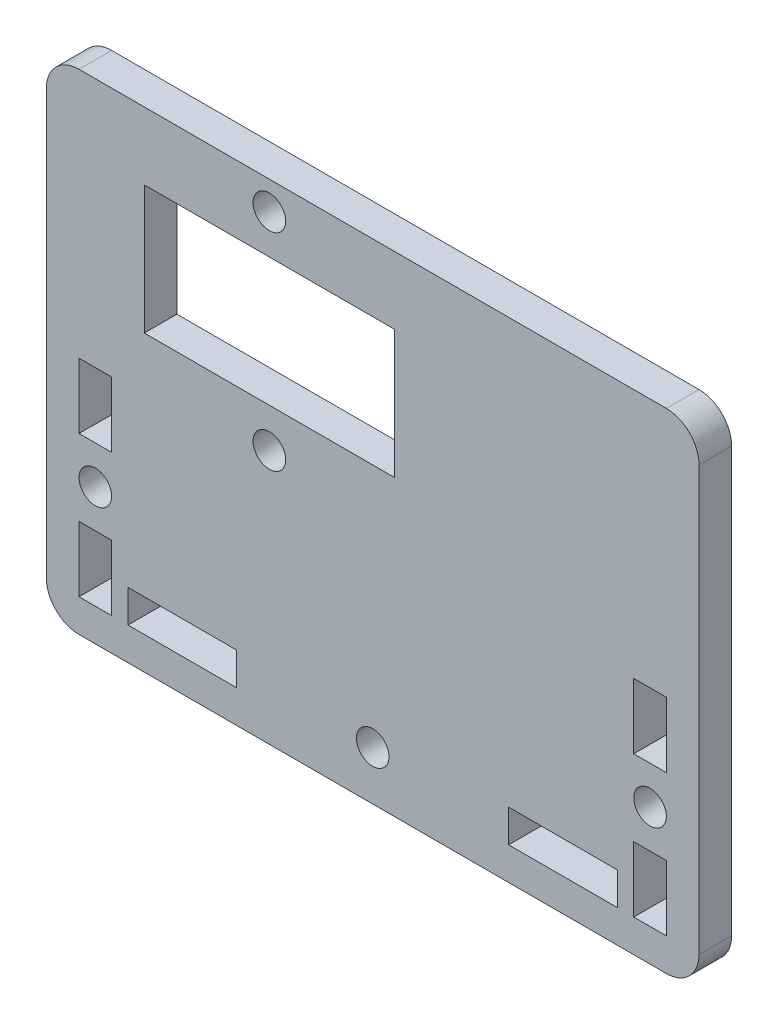
from build123d import *

# Parameters (mm, degrees)
ESQUISSE12_R        = 1.5
ESQUISSE12_W        = 3
ESQUISSE12_H        = 6
ESQUISSE12_W_2      = 10
ESQUISSE12_H_2      = 3
ESQUISSE12_W_3      = 23
ESQUISSE12_H_3      = 11.8
BOSS_EXTRU_12_DEPTH = 3


with BuildPart() as part:
    # Esquisse12 → Boss.-Extru.12 (new body)
    with BuildSketch(Plane.XY):
        with BuildLine():
            Line((218.080291561, -14.564673514), (164.080291561, -14.564673514))
            ThreePointArc((164.080291561, -14.564673514), (161.958971217, -13.685993857), (161.080291561, -11.564673514))
            Line((161.080291561, -11.564673514), (161.080291561, 27.435326486))
            ThreePointArc((161.080291561, 27.435326486), (161.958971217, 29.55664683), (164.080291561, 30.435326486))
            Line((164.080291561, 30.435326486), (218.080291561, 30.435326486))
            ThreePointArc((218.080291561, 30.435326486), (220.201611904, 29.55664683), (221.080291561, 27.435326486))
            Line((221.080291561, 27.435326486), (221.080291561, -11.564673514))
            ThreePointArc((221.080291561, -11.564673514), (220.201611904, -13.685993857), (218.080291561, -14.564673514))
        make_face()
        with Locations((191.080291561, -10.064673514)):
            Circle(ESQUISSE12_R, mode=Mode.SUBTRACT)
        with Locations((181.580291561, 8.835326486)):
            Circle(ESQUISSE12_R, mode=Mode.SUBTRACT)
        with Locations((181.580291561, 27.835326486)):
            Circle(ESQUISSE12_R, mode=Mode.SUBTRACT)
        with Locations((216.580291561, -2.064673514)):
            Circle(ESQUISSE12_R, mode=Mode.SUBTRACT)
        with Locations((165.580291561, -2.064673514)):
            Circle(ESQUISSE12_R, mode=Mode.SUBTRACT)
        with Locations((165.580291561, -8.564673514)):
            Rectangle(ESQUISSE12_W, ESQUISSE12_H, mode=Mode.SUBTRACT)
        with Locations((173.580291561, -10.064673514)):
            Rectangle(ESQUISSE12_W_2, ESQUISSE12_H_2, mode=Mode.SUBTRACT)
        with Locations((216.580291561, -8.564673514)):
            Rectangle(ESQUISSE12_W, ESQUISSE12_H, mode=Mode.SUBTRACT)
        with Locations((208.580291561, -10.064673514)):
            Rectangle(ESQUISSE12_W_2, ESQUISSE12_H_2, mode=Mode.SUBTRACT)
        with Locations((165.580291561, 4.435326486)):
            Rectangle(ESQUISSE12_W, ESQUISSE12_H, mode=Mode.SUBTRACT)
        with Locations((216.580291561, 4.435326486)):
            Rectangle(ESQUISSE12_W, ESQUISSE12_H, mode=Mode.SUBTRACT)
        with Locations((181.580291561, 18.335326486)):
            Rectangle(ESQUISSE12_W_3, ESQUISSE12_H_3, mode=Mode.SUBTRACT)
    extrude(amount=BOSS_EXTRU_12_DEPTH)


solid = part.part
